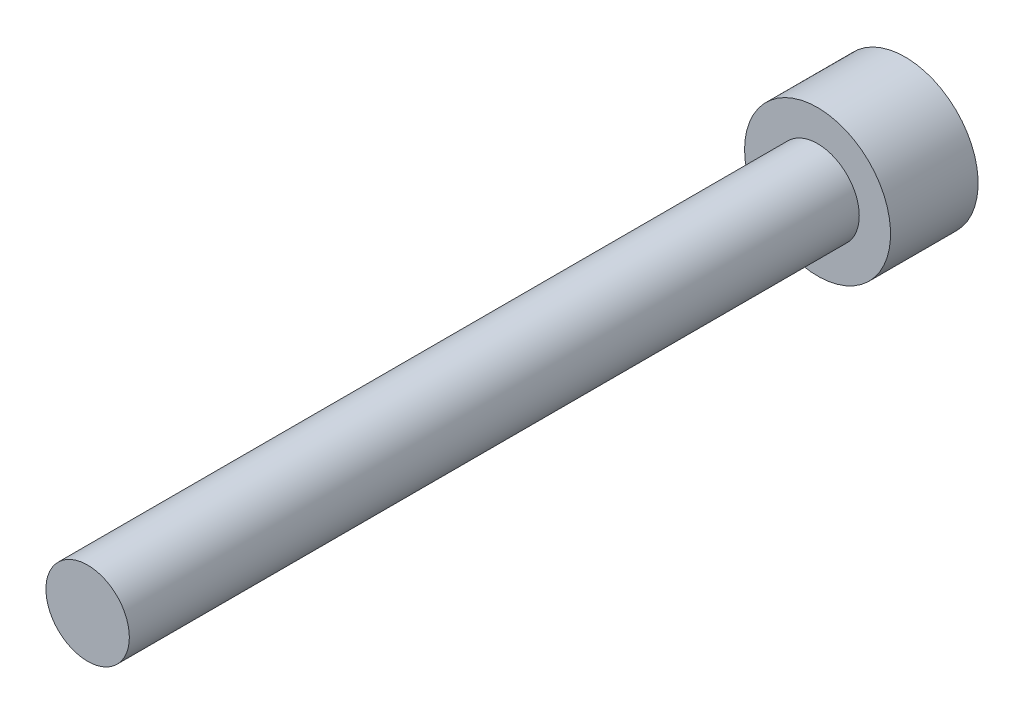
from build123d import *

# Parameters (mm, degrees)
SKETCH1_R           = 2
BOSS_EXTRUDE1_DEPTH = 35
SKETCH2_R           = 3.5
BOSS_EXTRUDE2_DEPTH = 4.2


with BuildPart() as part:
    # Sketch1 → Boss-Extrude1 (new body)
    with BuildSketch(Plane.XY):
        Circle(SKETCH1_R)
    extrude(amount=BOSS_EXTRUDE1_DEPTH)

    # Sketch2 → Boss-Extrude2 (add)
    with BuildSketch(Plane(origin=(0, 0, 0), x_dir=(-1, 0, 0), z_dir=(0, 0, -1))):
        Circle(SKETCH2_R)
    extrude(amount=BOSS_EXTRUDE2_DEPTH)


solid = part.part
